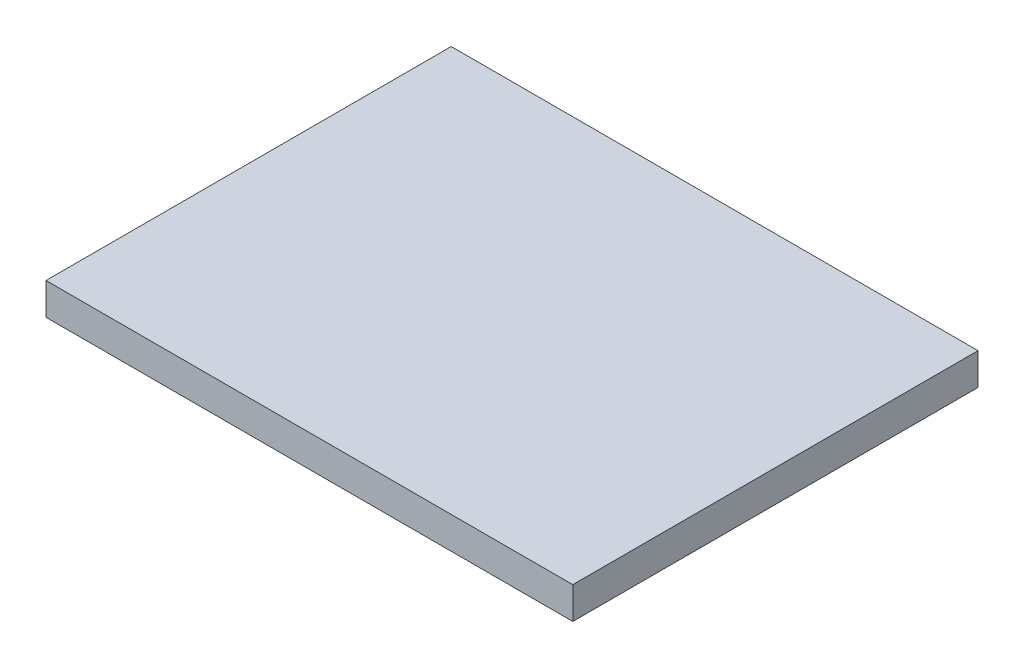
from build123d import *

# Parameters (mm, degrees)
SKETCH1_W           = 165.1
SKETCH1_H           = 127
BOSS_EXTRUDE1_DEPTH = 10


with BuildPart() as part:
    # Sketch1 → Boss-Extrude1 (new body)
    with BuildSketch(Plane(origin=(0, 0, 0), x_dir=(1, 0, 0), z_dir=(0, 1, 0))):
        with Locations((-21.614037855, 1.302050473)):
            Rectangle(SKETCH1_W, SKETCH1_H)
    extrude(amount=BOSS_EXTRUDE1_DEPTH)


solid = part.part
